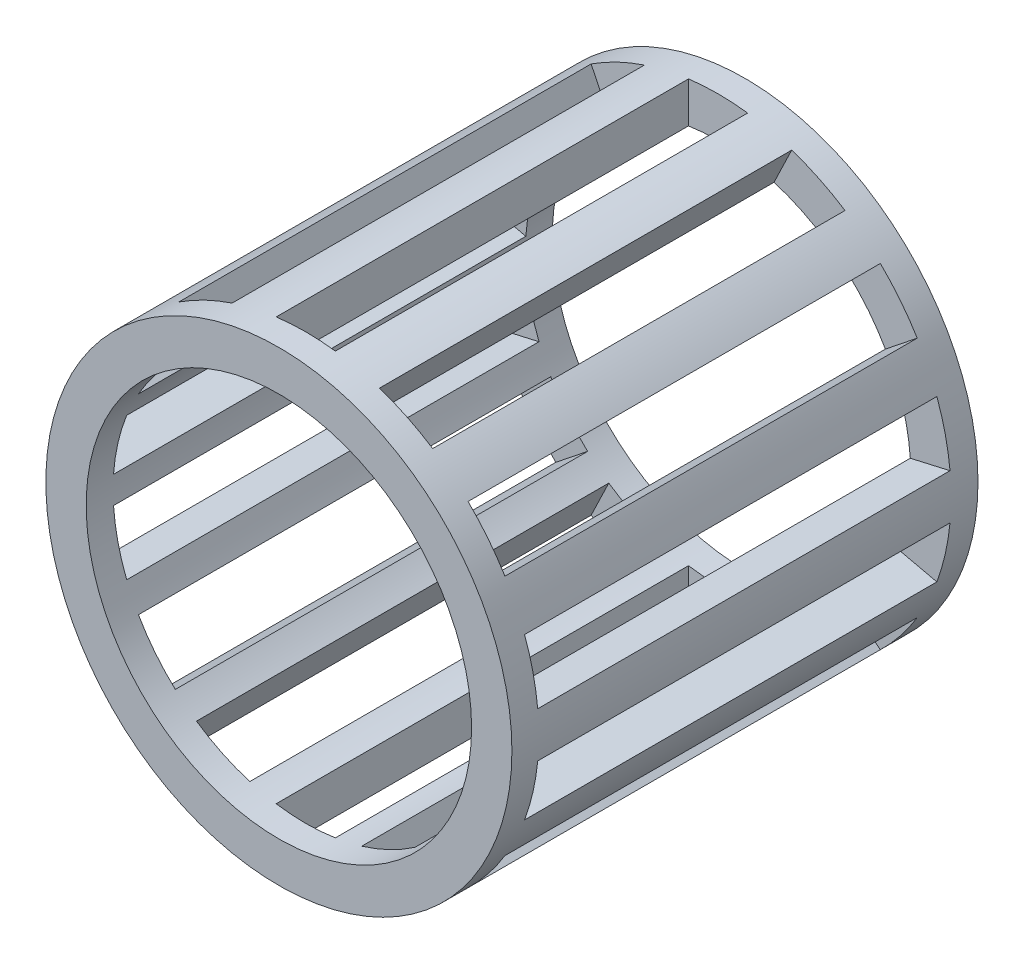
from build123d import *

# Parameters (mm, degrees)
SKETCH_1_R               = 6.5
SKETCH_1_R_2             = 5.375
EXTRUDE_1_DEPTH          = 13
SKETCH_2_W               = 1.65
SKETCH_2_H               = 11.5
CUT_EXTRUDE_1_DEPTH      = 6.5
PATTERN_CIRCULAR_1_COUNT = 14


with BuildPart() as part:
    # Эскиз1 → Бобышка-Вытянуть1 (new body)
    with BuildSketch(Plane.XY):
        with Locations(Location((0, 0, 0), (0, 0, 180))):
            Circle(SKETCH_1_R)
        with Locations(Location((0, 0, 0), (0, 0, 180))):
            Circle(SKETCH_1_R_2, mode=Mode.SUBTRACT)
    extrude(amount=EXTRUDE_1_DEPTH)

    # Эскиз2 → Вырез-Вытянуть1 (cut)
    with BuildSketch(Plane(origin=(0, 0, 0), x_dir=(1, 0, 0), z_dir=(0, 1, 0))):
        with Locations((0, -6.5)):
            Rectangle(SKETCH_2_W, SKETCH_2_H)
    cut_extrude_1 = extrude(amount=-CUT_EXTRUDE_1_DEPTH, mode=Mode.SUBTRACT)

    # Круговой массив1: Вырез-Вытянуть1 ×14 about axis
    pattern_circular_1_axis = Axis((0, 0, 0), (0, 0, 1))
    for i in range(1, PATTERN_CIRCULAR_1_COUNT):
        add(cut_extrude_1.rotate(pattern_circular_1_axis, i * 360 / PATTERN_CIRCULAR_1_COUNT), mode=Mode.SUBTRACT)


solid = part.part
